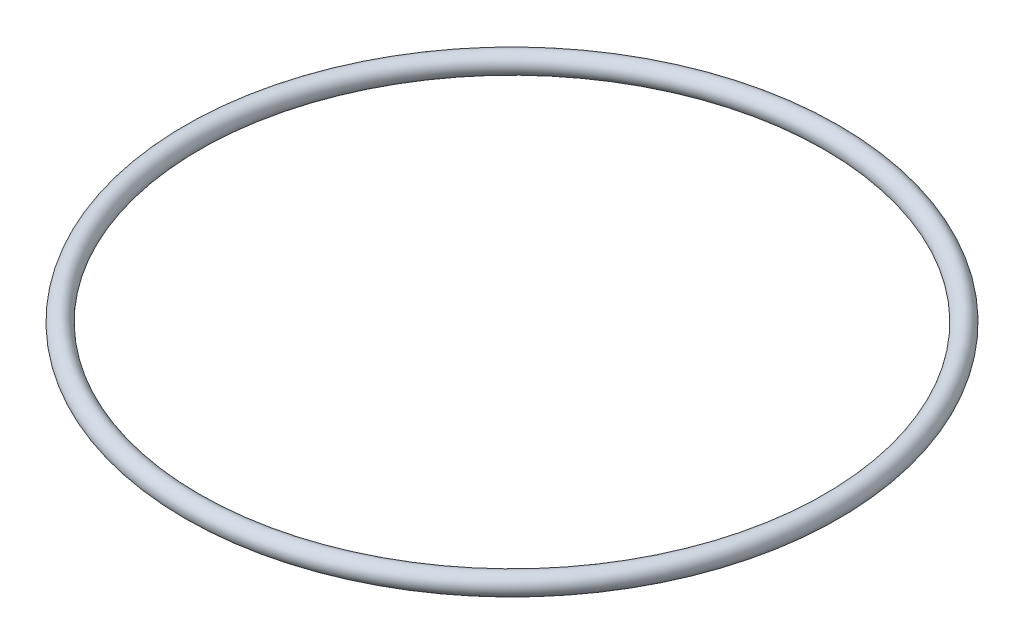
from build123d import *

# Parameters (mm, degrees)
RECONSTRUCTED_NOMINAL_AXIAL_PROFILE_R = 1


with BuildPart() as part:
    # Reconstructed nominal axial profile → Native revolved geometry (revolve)
    with BuildSketch(Plane.XY, mode=Mode.PRIVATE) as native_revolved_geometry_sk:
        with Locations((32, 0)):
            Circle(RECONSTRUCTED_NOMINAL_AXIAL_PROFILE_R)
    revolve(native_revolved_geometry_sk.sketch.rotate(Axis((0, -500, 0), (0, 1, 0)), 90), axis=Axis((0, -500, 0), (0, 1, 0)))


solid = part.part
